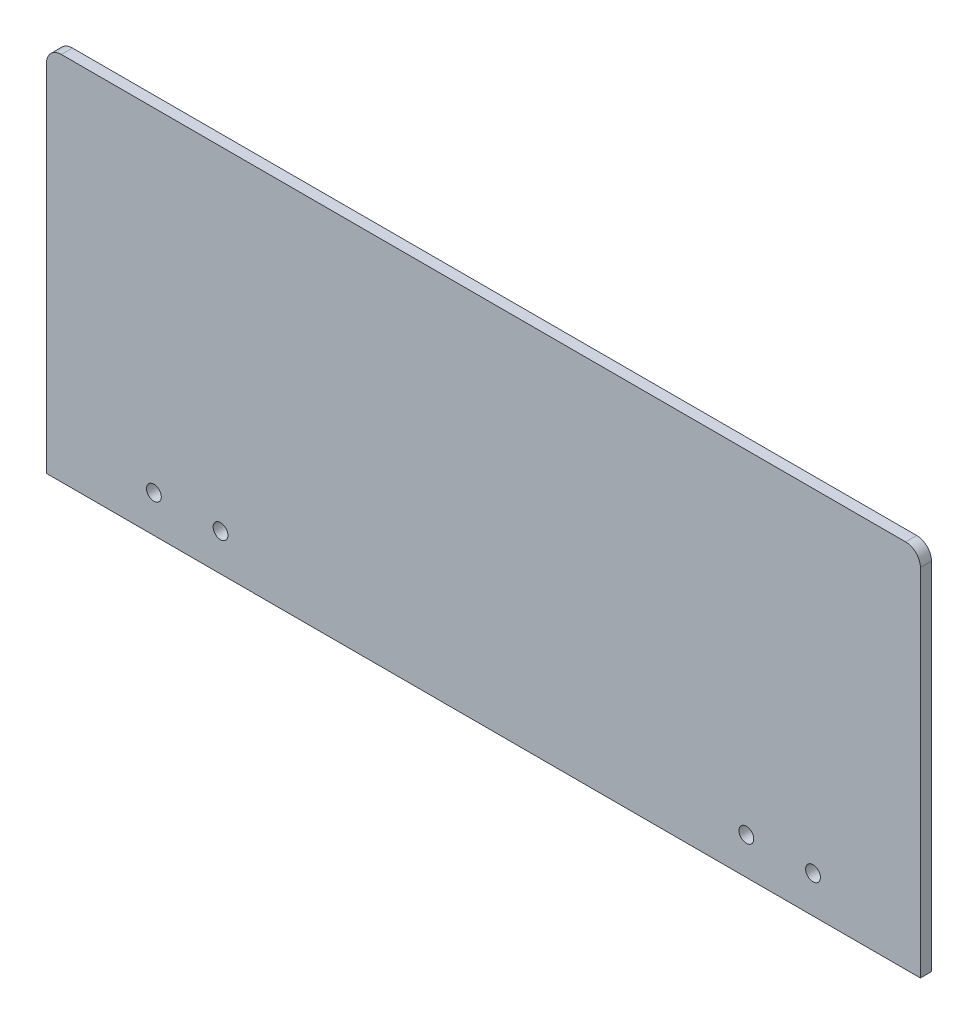
from build123d import *

# Parameters (mm, degrees)
ESQUISSE1_W             = 236
ESQUISSE1_H             = 100
BOSS_EXTRU_1_DEPTH      = 3
ENL_V_MAT_EXTRU_1_REACH = 196.828
ESQUISSE3_R             = 2
CONG_1_R                = 4


with BuildPart() as part:
    # Esquisse1 → Boss.-Extru.1 (new body)
    with BuildSketch(Plane.XY):
        with Locations((0, -105)):
            Rectangle(ESQUISSE1_W, ESQUISSE1_H)
    extrude(amount=BOSS_EXTRU_1_DEPTH)

    # Esquisse3 → Enlèv. mat.-Extru.1 (cut, up to next)
    with BuildSketch(Plane.XY.offset(3), mode=Mode.PRIVATE) as enl_v_mat_extru_1_sk1:
        with Locations((-71, -145)):
            Circle(ESQUISSE3_R)
    enl_v_mat_extru_1_tool1 = extrude(enl_v_mat_extru_1_sk1.sketch, amount=-ENL_V_MAT_EXTRU_1_REACH, mode=Mode.PRIVATE) & part.part
    # Esquisse3 → Enlèv. mat.-Extru.1 (cut, up to next)
    with BuildSketch(Plane.XY.offset(3), mode=Mode.PRIVATE) as enl_v_mat_extru_1_sk2:
        with Locations((-89, -145)):
            Circle(ESQUISSE3_R)
    enl_v_mat_extru_1_tool2 = extrude(enl_v_mat_extru_1_sk2.sketch, amount=-ENL_V_MAT_EXTRU_1_REACH, mode=Mode.PRIVATE) & part.part
    enl_v_mat_extru_1_1 = enl_v_mat_extru_1_tool1.solids().sort_by_distance((-71, -145, 3))[0]
    add(enl_v_mat_extru_1_1, mode=Mode.SUBTRACT)
    enl_v_mat_extru_1_2 = enl_v_mat_extru_1_tool2.solids().sort_by_distance((-89, -145, 3))[0]
    add(enl_v_mat_extru_1_2, mode=Mode.SUBTRACT)
    enl_v_mat_extru_1 = enl_v_mat_extru_1_1 + enl_v_mat_extru_1_2  # Enlèv. mat.-Extru.1 as one shape, for the pattern or mirror that repeats it

    # Symétrie1: Enlèv. mat.-Extru.1 across plane
    add(enl_v_mat_extru_1.mirror(Plane(origin=(0, 0, 0), x_dir=(0, 0, 1), z_dir=(1, 0, 0))), mode=Mode.SUBTRACT)

    # Congé1
    cong_1_edges = [part.edges().sort_by_distance(p)[0] for p in [
        (-118, -55, 1.5),
        (118, -55, 1.5),
    ]]
    fillet(cong_1_edges, radius=CONG_1_R)


solid = part.part
